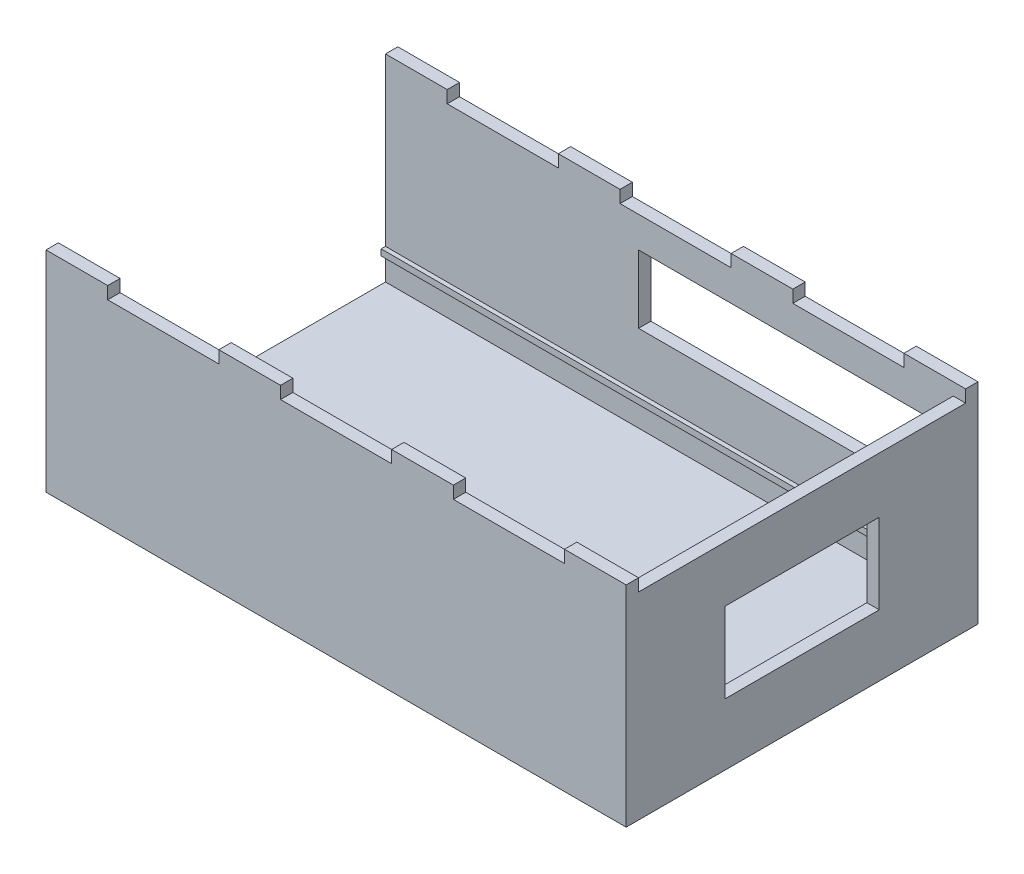
from build123d import *

# Parameters (mm, degrees)
SKETCH1_W           = 94
SKETCH1_H           = 57
BOSS_EXTRUDE1_DEPTH = 1
BOSS_EXTRUDE3_DEPTH = 30
SKETCH5_W           = 0.7
SKETCH5_H           = 1
BOSS_EXTRUDE4_DEPTH = 92
SKETCH6_W           = 46
SKETCH6_H           = 11
CUT_EXTRUDE2_DEPTH  = 30
SKETCH7_W           = 10
SKETCH7_H           = 2
BOSS_EXTRUDE5_DEPTH = 2
SKETCH8_W           = 25
SKETCH8_H           = 13
CUT_EXTRUDE3_DEPTH  = 2
SKETCH9_W           = 38
SKETCH9_H           = 1
BOSS_EXTRUDE6_DEPTH = 1
SKETCH10_W          = 1
SKETCH10_H          = 1
BOSS_EXTRUDE7_DEPTH = 50
BOSS_EXTRUDE8_DEPTH = 1
SKETCH13_W          = 94
SKETCH13_H          = 57
BOSS_EXTRUDE9_DEPTH = 1


with BuildPart() as part:
    # Sketch1 → Boss-Extrude1 (new body)
    with BuildSketch(Plane(origin=(0, 0, 0), x_dir=(1, 0, 0), z_dir=(0, 1, 0))):
        with Locations((-9.450515464, -3.911340206)):
            Rectangle(SKETCH1_W, SKETCH1_H)
    extrude(amount=BOSS_EXTRUDE1_DEPTH)

    # Sketch2 → Boss-Extrude3 (add)
    with BuildSketch(Plane(origin=(0, 1, 0), x_dir=(1, 0, 0), z_dir=(0, 1, 0))):
        Polygon((-56.450515464, 24.588659794), (37.549484536, 24.588659794), (37.549484536, -32.411340206), (-56.450515464, -32.411340206), (-56.450515464, -30.411340206), (-54.450515464, -30.411340206), (35.549484536, -30.411340206), (35.549484536, 22.588659794), (-54.450515464, 22.588659794), (-56.450515464, 22.588659794), align=None)
    extrude(amount=BOSS_EXTRUDE3_DEPTH)

    # Sketch5 → Boss-Extrude4 (add)
    with BuildSketch(Plane.ZY.offset(56.450515464)):
        with Locations((-22.238659794, 5.5)):
            Rectangle(SKETCH5_W, SKETCH5_H)
        with Locations((30.061340206, 5.5)):
            Rectangle(SKETCH5_W, SKETCH5_H)
    extrude(amount=-BOSS_EXTRUDE4_DEPTH)

    # Sketch6 → Cut-Extrude2 (cut)
    with BuildSketch(Plane(origin=(0, 0, -24.588659794), x_dir=(-1, 0, 0), z_dir=(0, 0, -1))):
        with Locations((-7.549484536, 20.5)):
            Rectangle(SKETCH6_W, SKETCH6_H)
    extrude(amount=-CUT_EXTRUDE2_DEPTH, mode=Mode.SUBTRACT)

    # Sketch7 → Boss-Extrude5 (add)
    with BuildSketch(Plane(origin=(0, 31, 0), x_dir=(1, 0, 0), z_dir=(0, 1, 0))):
        with Locations((-51.450515464, 23.588659794)):
            Rectangle(SKETCH7_W, SKETCH7_H)
        with Locations((-23.450515464, 23.588659794)):
            Rectangle(SKETCH7_W, SKETCH7_H)
        with Locations((4.549484536, 23.588659794)):
            Rectangle(SKETCH7_W, SKETCH7_H)
        with Locations((32.549484536, 23.588659794)):
            Rectangle(SKETCH7_W, SKETCH7_H)
        with Locations((-51.450515464, -31.411340206)):
            Rectangle(SKETCH7_W, SKETCH7_H)
        with Locations((-23.450515464, -31.411340206)):
            Rectangle(SKETCH7_W, SKETCH7_H)
        with Locations((4.549484536, -31.411340206)):
            Rectangle(SKETCH7_W, SKETCH7_H)
        with Locations((32.549484536, -31.411340206)):
            Rectangle(SKETCH7_W, SKETCH7_H)
    extrude(amount=BOSS_EXTRUDE5_DEPTH)

    # Sketch8 → Cut-Extrude3 (cut)
    with BuildSketch(Plane(origin=(37.549484536, 0, 0), x_dir=(0, 0, -1), z_dir=(1, 0, 0))):
        with Locations((-3.911340206, 15.5)):
            Rectangle(SKETCH8_W, SKETCH8_H)
    extrude(amount=-CUT_EXTRUDE3_DEPTH, mode=Mode.SUBTRACT)

    # Sketch9 → Boss-Extrude6 (add)
    with BuildSketch(Plane.ZY.offset(-35.549484536)):
        with Locations((11.411340206, 23.5)):
            Rectangle(SKETCH9_W, SKETCH9_H)
    extrude(amount=BOSS_EXTRUDE6_DEPTH)

    # Sketch10 → Boss-Extrude7 (add)
    with BuildSketch(Plane.ZY.offset(-34.549484536)):
        with Locations((29.911340206, 23.5)):
            Rectangle(SKETCH10_W, SKETCH10_H)
    extrude(amount=BOSS_EXTRUDE7_DEPTH)

    # Sketch11 → Boss-Extrude8 (add)
    with BuildSketch(Plane(origin=(0, 25.7, 0), x_dir=(1, 0, 0), z_dir=(0, 1, 0))):
        Polygon((34.549484536, 7.588659794), (35.549484536, 7.588659794), (35.549484536, -30.411340206), (-15.450515464, -30.411340206), (-15.450515464, -29.411340206), (34.549484536, -29.411340206), align=None)
    extrude(amount=BOSS_EXTRUDE8_DEPTH)

    # Sketch13 → Boss-Extrude9 (add)
    with BuildSketch(Plane.XZ):
        with Locations((-9.450515464, 3.911340206)):
            Rectangle(SKETCH13_W, SKETCH13_H)
    extrude(amount=BOSS_EXTRUDE9_DEPTH)


solid = part.part
